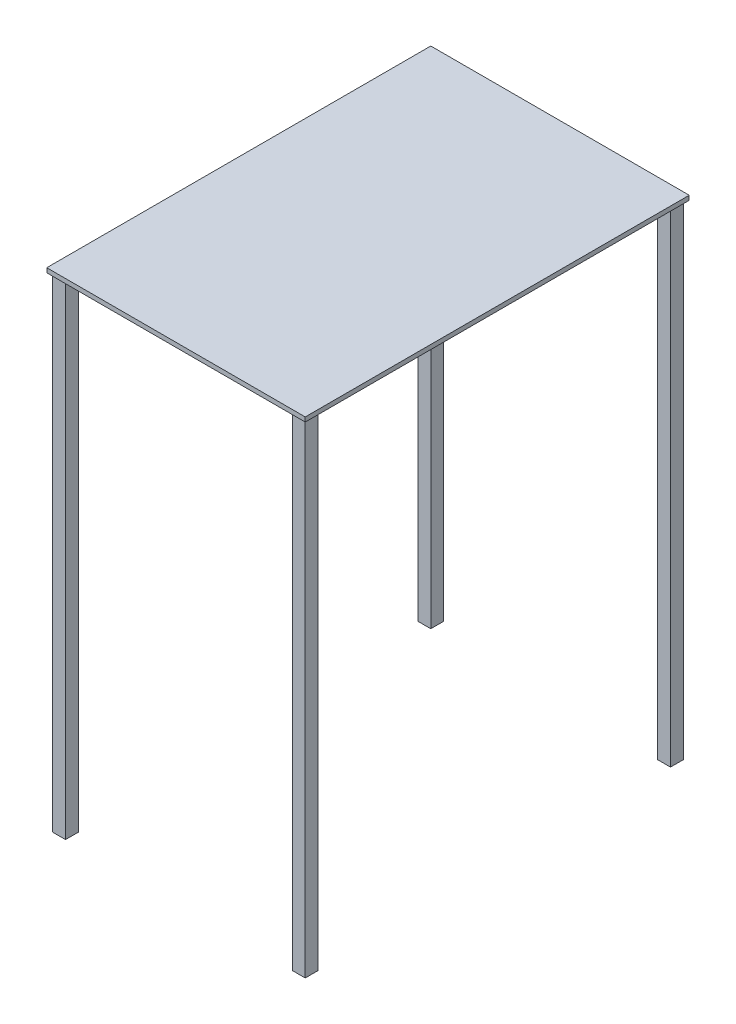
from build123d import *

# Parameters (mm, degrees)
SKETCH1_W               = 175
SKETCH1_H               = 260
BOSS_EXTRUDE1_DEPTH     = 3
SKETCH4_W               = 8.7
SKETCH4_H               = 8.7
BOSS_EXTRUDE3_DEPTH     = 328
MIRROR5_COPY_1_SKETCH_W = 8.7
MIRROR5_COPY_1_SKETCH_H = 8.7
MIRROR5_COPY_1_DEPTH    = 328
SKETCH6_W               = 38
SKETCH6_H               = 39
SKETCH6_W_2             = 34
SKETCH6_H_2             = 35
EXTRUDE_THIN1_DEPTH     = 10
SKETCH7_W               = 5.74
SKETCH7_H               = 5.74
BOSS_EXTRUDE5_DEPTH     = 8.5
SKETCH9_R               = 10.5
SKETCH9_R_2             = 6.5
EXTRUDE_THIN2_DEPTH     = 18
CUT_EXTRUDE1_DEPTH      = 367.180283467
CUT_EXTRUDE1_DEPTH_BACK = 367.180283467
SKETCH10_R              = 2.5
SKETCH11_R              = 2.5
BOSS_EXTRUDE6_DEPTH     = 3
CUT_EXTRUDE2_DEPTH      = 1
MIRROR7_COPY_1_SKETCH_R = 2.5
MIRROR7_COPY_1_DEPTH    = 3
MIRROR7_COPY_2_DEPTH    = 1


with BuildPart() as part:
    # Sketch1 → Boss-Extrude1 (new body)
    with BuildSketch(Plane(origin=(0, 0, 0), x_dir=(1, 0, 0), z_dir=(0, 1, 0))):
        Rectangle(SKETCH1_W, SKETCH1_H)
    extrude(amount=BOSS_EXTRUDE1_DEPTH)

    # Sketch4 → Boss-Extrude3 (add)
    with BuildSketch(Plane.XZ):
        with Locations((81.15, -123.65)):
            Rectangle(SKETCH4_W, SKETCH4_H)
    boss_extrude3 = extrude(amount=BOSS_EXTRUDE3_DEPTH)

    # Mirror3: Boss-Extrude3 across plane
    add(boss_extrude3.mirror(Plane.XY))

    # Mirror5: Boss-Extrude3 across plane
    add(boss_extrude3.mirror(Plane(origin=(0, 0, 0), x_dir=(0, 0, 1), z_dir=(1, 0, 0))))

    # Mirror5 copy 1 sketch → Mirror5 copy 1 (add)
    with BuildSketch(Plane(origin=(0, 0, 0), x_dir=(-1, 0, 0), z_dir=(0, -1, 0))):
        with Locations((81.15, -123.65)):
            Rectangle(MIRROR5_COPY_1_SKETCH_W, MIRROR5_COPY_1_SKETCH_H)
    extrude(amount=MIRROR5_COPY_1_DEPTH)

    # Sketch6 → Extrude-Thin1 (add)
    with BuildSketch(Plane(origin=(0, 0, -130), x_dir=(-1, 0, 0), z_dir=(0, 0, -1))):
        with Locations((0, -19.5)):
            Rectangle(SKETCH6_W, SKETCH6_H)
        with Locations((0, -19.5)):
            Rectangle(SKETCH6_W_2, SKETCH6_H_2, mode=Mode.SUBTRACT)
    extrude(amount=-EXTRUDE_THIN1_DEPTH)

    # Sketch7 → Boss-Extrude5 (add)
    with BuildSketch(Plane.XY.offset(-120)):
        with Locations((14.13, -4.87)):
            Rectangle(SKETCH7_W, SKETCH7_H)
        with Locations((-14.13, -4.87)):
            Rectangle(SKETCH7_W, SKETCH7_H)
        with Locations((-14.13, -34.13)):
            Rectangle(SKETCH7_W, SKETCH7_H)
        with Locations((14.13, -34.13)):
            Rectangle(SKETCH7_W, SKETCH7_H)
    extrude(amount=-BOSS_EXTRUDE5_DEPTH)

    # Sketch9 → Extrude-Thin2 (add)
    with BuildSketch(Plane.XZ):
        Circle(SKETCH9_R)
        Circle(SKETCH9_R_2, mode=Mode.SUBTRACT)
    extrude(amount=EXTRUDE_THIN2_DEPTH)

    # Sketch10 → Cut-Extrude1 (cut, two sides: drawn at the far end of the back side and taken through both)
    with BuildSketch(Plane(origin=(10.5, 0, 0), x_dir=(0, 0, -1), z_dir=(1, 0, 0)).offset(-CUT_EXTRUDE1_DEPTH_BACK)):
        with Locations((0, -10)):
            Circle(SKETCH10_R)
    extrude(amount=CUT_EXTRUDE1_DEPTH + CUT_EXTRUDE1_DEPTH_BACK, mode=Mode.SUBTRACT)

    # Sketch11 → Boss-Extrude6 (add)
    with BuildSketch(Plane.XZ):
        with Locations(Location((-72.5, 80, 0), (0, 0, 90))):
            Circle(SKETCH11_R)
    boss_extrude6 = extrude(amount=BOSS_EXTRUDE6_DEPTH)

    # Sketch12 → Cut-Extrude2 (cut)
    with BuildSketch(Plane.XZ.offset(3)):
        Polygon((-70.5, 80), (-71.5, 81.732050808), (-73.5, 81.732050808), (-74.5, 80), (-73.5, 78.267949192), (-71.5, 78.267949192), align=None)
    cut_extrude2 = extrude(amount=-CUT_EXTRUDE2_DEPTH, mode=Mode.SUBTRACT)

    # Mirror6: Boss-Extrude6, Cut-Extrude2 across plane
    add(boss_extrude6.mirror(Plane(origin=(0, 0, 0), x_dir=(0, 0, 1), z_dir=(1, 0, 0))))
    add(cut_extrude2.mirror(Plane(origin=(0, 0, 0), x_dir=(0, 0, 1), z_dir=(1, 0, 0))), mode=Mode.SUBTRACT)

    # Mirror7: Boss-Extrude6, Cut-Extrude2 across plane
    add(boss_extrude6.mirror(Plane.XY))
    add(cut_extrude2.mirror(Plane.XY), mode=Mode.SUBTRACT)

    # Mirror7 copy 1 sketch → Mirror7 copy 1 (add)
    with BuildSketch(Plane(origin=(0, 0, 0), x_dir=(-1, 0, 0), z_dir=(0, -1, 0))):
        with Locations(Location((-72.5, 80, 0), (0, 0, 90))):
            Circle(MIRROR7_COPY_1_SKETCH_R)
    extrude(amount=MIRROR7_COPY_1_DEPTH)

    # Mirror7 copy 2 sketch → Mirror7 copy 2 (cut)
    with BuildSketch(Plane(origin=(0, -3, 0), x_dir=(-1, 0, 0), z_dir=(0, -1, 0))):
        Polygon((-70.5, 80), (-71.5, 81.732050808), (-73.5, 81.732050808), (-74.5, 80), (-73.5, 78.267949192), (-71.5, 78.267949192), align=None)
    extrude(amount=-MIRROR7_COPY_2_DEPTH, mode=Mode.SUBTRACT)


solid = part.part
